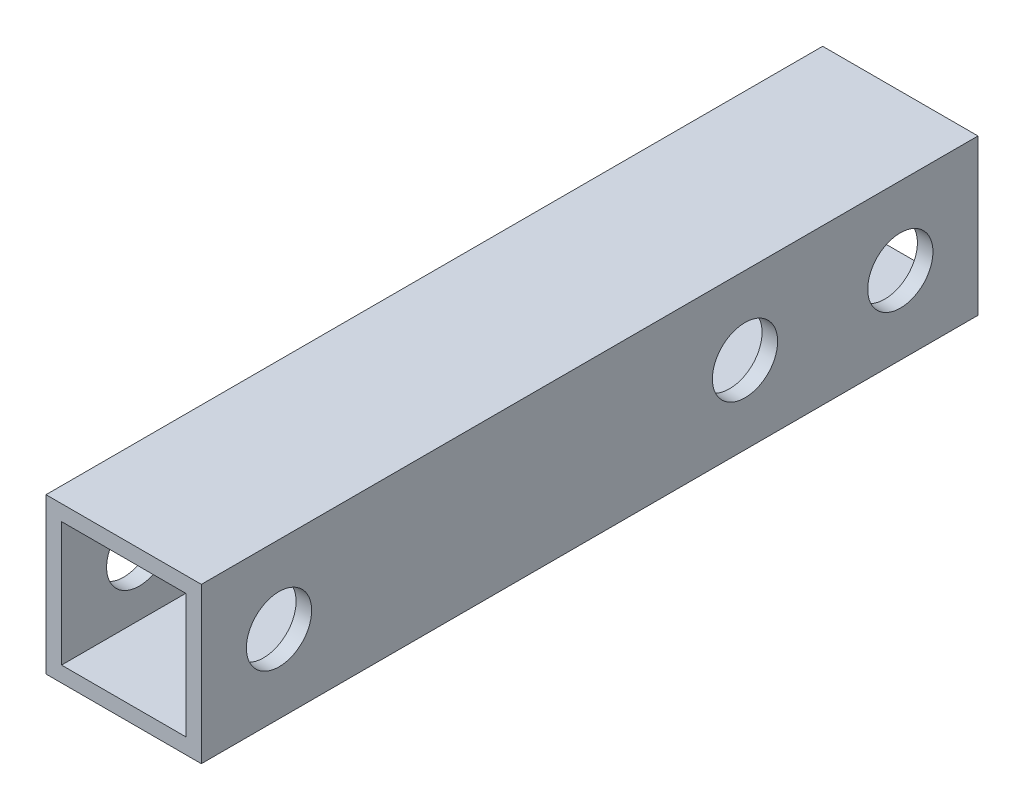
from build123d import *

# Parameters (mm, degrees)
SKETCH_1_W          = 10
SKETCH_1_H          = 10
SKETCH_1_W_2        = 8
SKETCH_1_H_2        = 8
EXTRUDE_1_DEPTH     = 50
CUT_EXTRUDE_1_REACH = 53.962
SKETCH_2_R          = 2.1


with BuildPart() as part:
    # ｽｹｯﾁ1 → 押し出し-薄板1 (new body)
    with BuildSketch(Plane.XY):
        with Locations((5, 5)):
            Rectangle(SKETCH_1_W, SKETCH_1_H)
        with Locations((5, 5)):
            Rectangle(SKETCH_1_W_2, SKETCH_1_H_2, mode=Mode.SUBTRACT)
    extrude(amount=EXTRUDE_1_DEPTH)

    # ｶｯﾄ - 押し出し1: up to this face of the body (flat: up to its plane)
    cut_extrude_1_end = Plane(part.part.faces().sort_by_distance((0, 5, 25))[0])
    # ｽｹｯﾁ2 → ｶｯﾄ - 押し出し1 (cut, up to the picked face)
    with BuildSketch(Plane(origin=(10, 0, 0), x_dir=(0, 0, -1), z_dir=(1, 0, 0)), mode=Mode.PRIVATE) as cut_extrude_1_sk1:
        with Locations((-5, 5)):
            Circle(SKETCH_2_R)
    cut_extrude_1_tool1 = split(extrude(cut_extrude_1_sk1.sketch, amount=-CUT_EXTRUDE_1_REACH, mode=Mode.PRIVATE), bisect_by=cut_extrude_1_end, keep=Keep.BOTH, mode=Mode.PRIVATE)
    # ｽｹｯﾁ2 → ｶｯﾄ - 押し出し1 (cut, up to the picked face)
    with BuildSketch(Plane(origin=(10, 0, 0), x_dir=(0, 0, -1), z_dir=(1, 0, 0)), mode=Mode.PRIVATE) as cut_extrude_1_sk2:
        with Locations((-15, 5)):
            Circle(SKETCH_2_R)
    cut_extrude_1_tool2 = split(extrude(cut_extrude_1_sk2.sketch, amount=-CUT_EXTRUDE_1_REACH, mode=Mode.PRIVATE), bisect_by=cut_extrude_1_end, keep=Keep.BOTH, mode=Mode.PRIVATE)
    # ｽｹｯﾁ2 → ｶｯﾄ - 押し出し1 (cut, up to the picked face)
    with BuildSketch(Plane(origin=(10, 0, 0), x_dir=(0, 0, -1), z_dir=(1, 0, 0)), mode=Mode.PRIVATE) as cut_extrude_1_sk3:
        with Locations((-45, 5)):
            Circle(SKETCH_2_R)
    cut_extrude_1_tool3 = split(extrude(cut_extrude_1_sk3.sketch, amount=-CUT_EXTRUDE_1_REACH, mode=Mode.PRIVATE), bisect_by=cut_extrude_1_end, keep=Keep.BOTH, mode=Mode.PRIVATE)
    add(cut_extrude_1_tool1.solids().sort_by(Axis((10, 5, 5), (-1, 0, 0)))[0], mode=Mode.SUBTRACT)
    add(cut_extrude_1_tool2.solids().sort_by(Axis((10, 5, 15), (-1, 0, 0)))[0], mode=Mode.SUBTRACT)
    add(cut_extrude_1_tool3.solids().sort_by(Axis((10, 5, 45), (-1, 0, 0)))[0], mode=Mode.SUBTRACT)


solid = part.part
